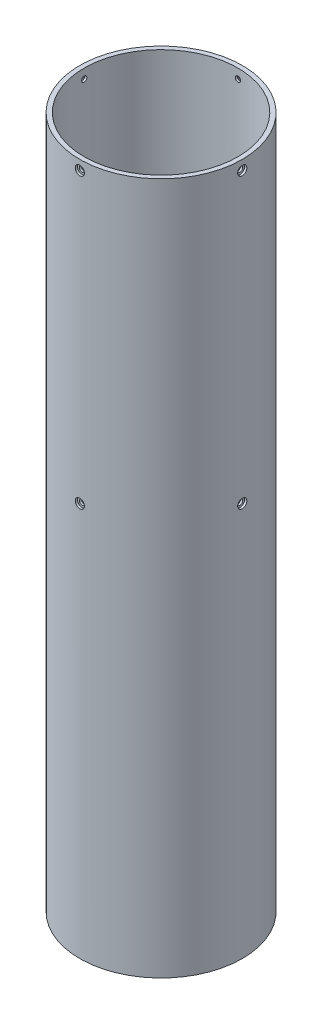
from build123d import *

# Parameters (mm, degrees)
SKETCH1_R                         = 53.721
SKETCH1_R_2                       = 50.8
BODY_EXTRUSION_DEPTH              = 457.2
UPPER_BULKHEAD_HOLES_REACH        = 474.717
UPPER_BULKHEAD_HOLES_END_RADIUS   = 50.8
SKETCH2_R                         = 1.7526
UPPER_BULKHEAD_HOLE_PATTERN_COUNT = 4
LOWER_BULKHEAD_HOLES_REACH        = 474.717
LOWER_BULKHEAD_HOLES_END_RADIUS   = 50.8
SKETCH3_R                         = 1.7526
LOWER_BULKHEAD_HOLE_PATTERN_COUNT = 4
SKETCH4_R                         = 3.0226
COUNTERSINK_DEPTH                 = 1.524
COUNTERSINK_PATTERN_COUNT         = 4


with BuildPart() as part:
    # Sketch1 → Body Extrusion (new body)
    with BuildSketch(Plane(origin=(0, 0, 0), x_dir=(1, 0, 0), z_dir=(0, 1, 0))):
        Circle(SKETCH1_R)
        Circle(SKETCH1_R_2, mode=Mode.SUBTRACT)
    extrude(amount=BODY_EXTRUSION_DEPTH)

    # Upper Bulkhead Holes: up to this cylinder (the profile starts outside it)
    upper_bulkhead_holes_end = Plane(origin=(0, 450.85, 0), z_dir=(0, -1, 0)) * Cylinder(UPPER_BULKHEAD_HOLES_END_RADIUS, 1052.034, mode=Mode.PRIVATE)
    # Sketch2 → Upper Bulkhead Holes (cut, up to the surface)
    with BuildSketch(Plane.XY.offset(53.721), mode=Mode.PRIVATE) as upper_bulkhead_holes_sk1:
        with Locations((0, 450.85)):
            Circle(SKETCH2_R)
    upper_bulkhead_holes_tool1 = extrude(upper_bulkhead_holes_sk1.sketch, amount=-UPPER_BULKHEAD_HOLES_REACH, mode=Mode.PRIVATE) - upper_bulkhead_holes_end
    upper_bulkhead_holes = upper_bulkhead_holes_tool1.solids().sort_by_distance((0, 450.85, 53.721))[0]
    add(upper_bulkhead_holes, mode=Mode.SUBTRACT)

    # Upper Bulkhead Hole Pattern: Upper Bulkhead Holes ×4 about axis
    upper_bulkhead_hole_pattern_axis = Axis((0, 457.2, 0), (0, -1, 0))
    for i in range(1, UPPER_BULKHEAD_HOLE_PATTERN_COUNT):
        add(upper_bulkhead_holes.rotate(upper_bulkhead_hole_pattern_axis, i * 360 / UPPER_BULKHEAD_HOLE_PATTERN_COUNT), mode=Mode.SUBTRACT)

    # Lower Bulkhead Holes: up to this cylinder (the profile starts outside it)
    lower_bulkhead_holes_end = Plane(origin=(0, 260.35, 0), z_dir=(0, -1, 0)) * Cylinder(LOWER_BULKHEAD_HOLES_END_RADIUS, 1052.034, mode=Mode.PRIVATE)
    # Sketch3 → Lower Bulkhead Holes (cut, up to the surface)
    with BuildSketch(Plane.XY.offset(53.721), mode=Mode.PRIVATE) as lower_bulkhead_holes_sk1:
        with Locations((0, 260.35)):
            Circle(SKETCH3_R)
    lower_bulkhead_holes_tool1 = extrude(lower_bulkhead_holes_sk1.sketch, amount=-LOWER_BULKHEAD_HOLES_REACH, mode=Mode.PRIVATE) - lower_bulkhead_holes_end
    lower_bulkhead_holes = lower_bulkhead_holes_tool1.solids().sort_by_distance((0, 260.35, 53.721))[0]
    add(lower_bulkhead_holes, mode=Mode.SUBTRACT)

    # Lower Bulkhead Hole Pattern: Lower Bulkhead Holes ×4 about axis
    lower_bulkhead_hole_pattern_axis = Axis((0, 457.2, 0), (0, -1, 0))
    for i in range(1, LOWER_BULKHEAD_HOLE_PATTERN_COUNT):
        add(lower_bulkhead_holes.rotate(lower_bulkhead_hole_pattern_axis, i * 360 / LOWER_BULKHEAD_HOLE_PATTERN_COUNT), mode=Mode.SUBTRACT)

    # Sketch4 → Countersink (cut)
    with BuildSketch(Plane.XY.offset(53.721)):
        with Locations((0, 450.85)):
            Circle(SKETCH4_R)
        with Locations((0, 260.35)):
            Circle(SKETCH4_R)
    countersink = extrude(amount=-COUNTERSINK_DEPTH, mode=Mode.SUBTRACT)

    # Countersink Pattern: Countersink ×4 about axis
    countersink_pattern_axis = Axis((0, 0, 0), (0, 1, 0))
    for i in range(1, COUNTERSINK_PATTERN_COUNT):
        add(countersink.rotate(countersink_pattern_axis, i * 360 / COUNTERSINK_PATTERN_COUNT), mode=Mode.SUBTRACT)


solid = part.part
